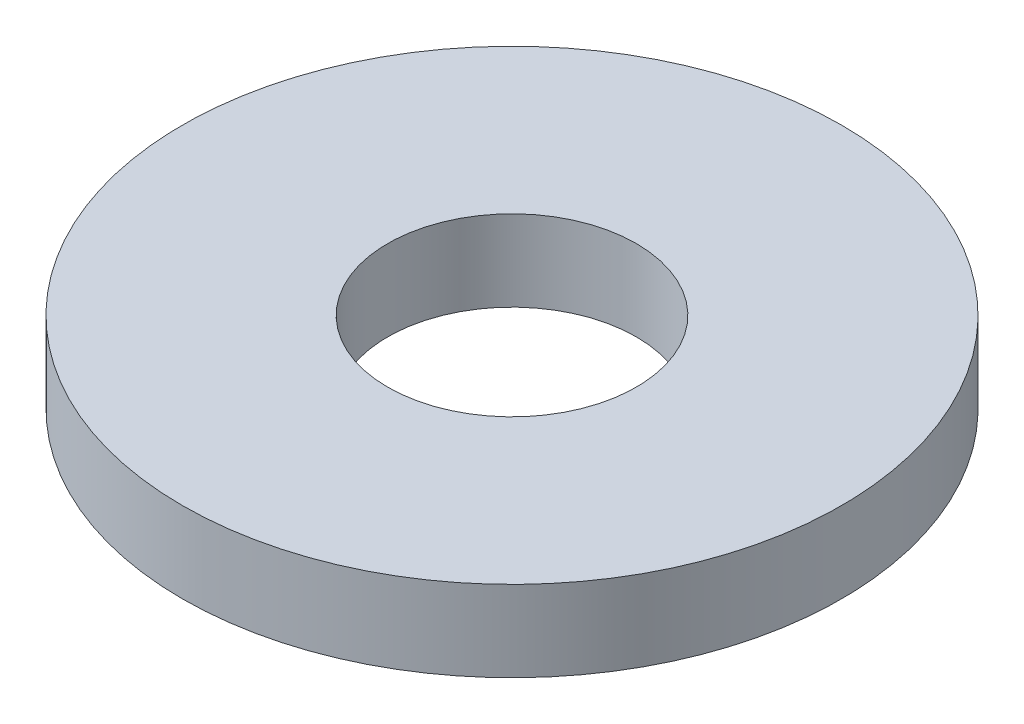
from build123d import *

# Parameters (mm, degrees)
SKETCH2_R           = 13.25
SKETCH2_R_2         = 5
BOSS_EXTRUDE1_DEPTH = 3.25


with BuildPart() as part:
    # Sketch2 → Boss-Extrude1 (new body)
    with BuildSketch(Plane(origin=(0, 0, 0), x_dir=(1, 0, 0), z_dir=(0, 1, 0))):
        with Locations(Location((0, 0, 0), (0, 0, 90))):
            Circle(SKETCH2_R)
        with Locations(Location((0, 0, 0), (0, 0, 90))):
            Circle(SKETCH2_R_2, mode=Mode.SUBTRACT)
    extrude(amount=BOSS_EXTRUDE1_DEPTH)


solid = part.part
